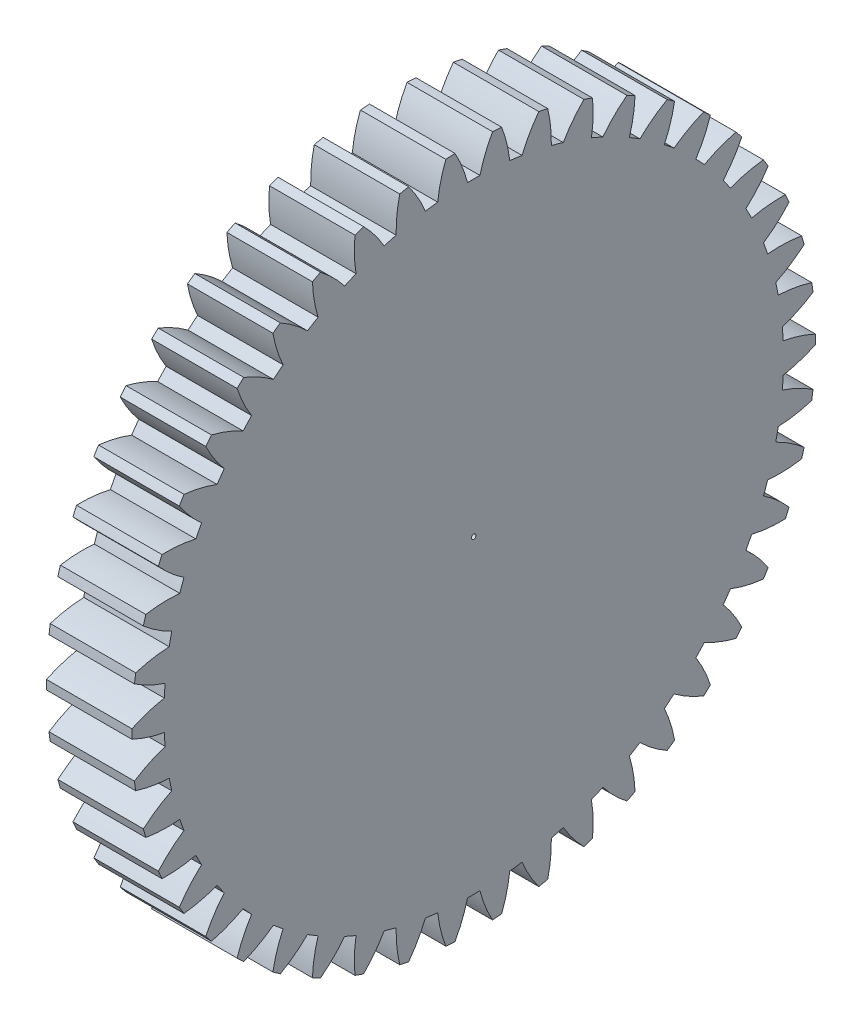
from build123d import *

# Parameters (mm, degrees)
BASPROSKE_W         = 12
BASPROSKE_H         = 60
TOOTHCUT_DEPTH      = 86.697141143
TEETHCUTS_COUNT     = 46
BORSKE_R            = 0.4
BORE_DEPTH          = 50.0000508
BOSS_EXTRUDE1_START = 3
BOSS_EXTRUDE1_DEPTH = 3


with BuildPart() as part:
    # BasProSke → Base-Revolve (revolve)
    with BuildSketch(Plane(origin=(0, 0, 0), x_dir=(1, 0, 0), z_dir=(0, 1, 0)), mode=Mode.PRIVATE) as base_revolve_sk:
        with Locations((6, 30)):
            Rectangle(BASPROSKE_W, BASPROSKE_H)
    revolve(base_revolve_sk.sketch.rotate(Axis((-10, 0, 0), (1, 0, 0)), 180), axis=Axis((-10, 0, 0), (1, 0, 0)))

    # TooCutSke → ToothCut (cut, through all)
    with BuildSketch(Plane(origin=(0, 0, 0), x_dir=(0, 0, -1), z_dir=(1, 0, 0))):
        with BuildLine():
            ThreePointArc((1.090953439, 54.363054519), (0, 54.374), (-1.090953439, 54.363054519))
            ThreePointArc((-1.090953439, 54.363054519), (-2.018224554, 57.221193322), (-3.310181513, 59.934058293))
            ThreePointArc((-3.310181513, 59.934058293), (0, 60.0254), (3.310181513, 59.934058293))
            ThreePointArc((3.310181513, 59.934058293), (2.018224554, 57.221193322), (1.090953439, 54.363054519))
        make_face()
    toothcut = extrude(amount=TOOTHCUT_DEPTH, mode=Mode.SUBTRACT)

    # TeethCuts: ToothCut ×46 about axis
    teethcuts_axis = Axis((0, 0, 0), (1, 0, 0))
    for i in range(1, TEETHCUTS_COUNT):
        add(toothcut.rotate(teethcuts_axis, i * 360 / TEETHCUTS_COUNT), mode=Mode.SUBTRACT)

    # BorSke → Bore (cut, symmetric)
    with BuildSketch(Plane(origin=(0, 0, 0), x_dir=(0, 0, -1), z_dir=(1, 0, 0))):
        with Locations(Location((0, 0, 0), (0, 0, 180))):
            Circle(BORSKE_R)
    extrude(amount=BORE_DEPTH, both=True, mode=Mode.SUBTRACT)

    # Sketch13 → Boss-Extrude1 (add)
    with BuildSketch(Plane.ZY.offset(BOSS_EXTRUDE1_START)):
        with BuildLine():
            ThreePointArc((54.310770987, -2.621455863), (57.21206929, -1.895710457), (59.994671195, -0.799642543))
            ThreePointArc((59.994671195, -0.799642543), (60, 0), (59.994671195, 0.799642543))
            ThreePointArc((59.994671195, 0.799642543), (57.21206929, 1.895710457), (54.310770987, 2.621455863))
            ThreePointArc((54.310770987, 2.621455863), (54.247241656, 3.710612984), (54.161872395, 4.798276213))
            ThreePointArc((54.161872395, 4.798276213), (56.937325529, 5.912322055), (59.544762236, 7.377078711))
            ThreePointArc((59.544762236, 7.377078711), (59.441156762, 8.169998946), (59.326992944, 8.96146797))
            ThreePointArc((59.326992944, 8.96146797), (56.421060448, 9.668429471), (53.447962674, 9.992355177))
            ThreePointArc((53.447962674, 9.992355177), (53.236718184, 11.062717254), (53.0040406, 12.128625482))
            ThreePointArc((53.0040406, 12.128625482), (55.601947124, 13.610219194), (57.985647019, 15.416378946))
            ThreePointArc((57.985647019, 15.416378946), (57.775037241, 16.187806269), (57.554165066, 16.956358204))
            ThreePointArc((57.554165066, 16.956358204), (54.579034003, 17.261043937), (51.589519945, 17.17711582))
            ThreePointArc((51.589519945, 17.17711582), (51.234495379, 18.208744032), (50.858843815, 19.233041407))
            ThreePointArc((50.858843815, 19.233041407), (53.230809647, 21.054583701), (55.346368911, 23.168501211))
            ThreePointArc((55.346368911, 23.168501211), (55.03267809, 23.904065391), (54.709211989, 24.635383567))
            ThreePointArc((54.709211989, 24.635383567), (51.720303423, 24.532117813), (48.770062069, 24.041899296))
            ThreePointArc((48.770062069, 24.041899296), (48.277870865, 25.015576362), (47.766242999, 25.979182161))
            ThreePointArc((47.766242999, 25.979182161), (49.868082903, 28.106741151), (51.67609267, 30.489038135))
            ThreePointArc((51.67609267, 30.489038135), (51.265164273, 31.175037002), (50.845129807, 31.855498346))
            ThreePointArc((50.845129807, 31.855498346), (47.898121448, 31.346204751), (45.042110214, 30.458827676))
            ThreePointArc((45.042110214, 30.458827676), (44.421920963, 31.356415835), (43.783847453, 32.241379905))
            ThreePointArc((43.783847453, 32.241379905), (45.576408128, 34.635323193), (47.043188597, 37.241621966))
            ThreePointArc((47.043188597, 37.241621966), (46.542677442, 37.86527666), (46.033899059, 38.482205464))
            ThreePointArc((46.033899059, 38.482205464), (43.183688097, 37.576371204), (40.475109069, 36.308365728))
            ThreePointArc((40.475109069, 36.308365728), (39.738474722, 37.113144609), (38.985841671, 37.902981745))
            ThreePointArc((38.985841671, 37.902981745), (40.435731104, 40.518714696), (41.53395893, 43.300464843))
            ThreePointArc((41.53395893, 43.300464843), (40.953188593, 43.850157857), (40.365143871, 44.392061906))
            ThreePointArc((40.365143871, 44.392061906), (37.664824343, 43.106560959), (35.154133224, 41.481547624))
            ThreePointArc((35.154133224, 41.481547624), (34.314775885, 42.178525721), (33.461603423, 42.858522751))
            ThreePointArc((33.461603423, 42.858522751), (34.541812916, 45.647319209), (35.251030193, 48.552701988))
            ThreePointArc((35.251030193, 48.552701988), (34.600819327, 49.018193581), (33.944462427, 49.474978227))
            ThreePointArc((33.944462427, 49.474978227), (31.444336177, 47.833757044), (29.178302391, 45.882006774))
            ThreePointArc((29.178302391, 45.882006774), (28.251857699, 46.458200703), (27.314038815, 47.015690568))
            ThreePointArc((27.314038815, 47.015690568), (28.00444611, 49.925600533), (28.311441461, 52.90049416))
            ThreePointArc((28.311441461, 52.90049416), (27.603902264, 53.273113104), (26.891459873, 53.636269314))
            ThreePointArc((26.891459873, 53.636269314), (24.638099523, 51.669900739), (22.658934991, 49.42777095))
            ThreePointArc((22.658934991, 49.42777095), (21.662660859, 49.872447308), (20.657665344, 50.297045028))
            ThreePointArc((20.657665344, 50.297045028), (20.945409459, 53.273862382), (20.844464142, 56.262850218))
            ThreePointArc((20.844464142, 56.262850218), (20.09277673, 56.535655327), (19.337520302, 56.798418187))
            ThreePointArc((19.337520302, 56.798418187), (17.372901692, 54.543531948), (15.717474506, 52.052789274))
            ThreePointArc((15.717474506, 52.052789274), (14.669929635, 52.357664582), (13.616478653, 52.641460704))
            ThreePointArc((13.616478653, 52.641460704), (13.49619946, 55.629732973), (12.989193896, 58.577135829))
            ThreePointArc((12.989193896, 58.577135829), (12.207360783, 58.745045261), (11.423359316, 58.902519997))
            ThreePointArc((11.423359316, 58.902519997), (9.784079572, 56.401120356), (8.483227208, 53.708162621))
            ThreePointArc((8.483227208, 53.708162621), (7.403925378, 53.86755763), (6.321642728, 54.005265569))
            ThreePointArc((6.321642728, 54.005265569), (5.795580801, 56.949326894), (4.891959543, 59.800240232))
            ThreePointArc((4.891959543, 59.800240232), (4.094544802, 59.860126151), (3.296402759, 59.909379306))
            ThreePointArc((3.296402759, 59.909379306), (2.012998563, 57.208062608), (1.090953439, 54.363054519))
            ThreePointArc((1.090953439, 54.363054519), (0, 54.374), (-1.090953439, 54.363054519))
            ThreePointArc((-1.090953439, 54.363054519), (-2.012998563, 57.208062608), (-3.296402759, 59.909379306))
            ThreePointArc((-3.296402759, 59.909379306), (-4.094544802, 59.860126151), (-4.891959543, 59.800240232))
            ThreePointArc((-4.891959543, 59.800240232), (-5.795580801, 56.949326894), (-6.321642728, 54.005265569))
            ThreePointArc((-6.321642728, 54.005265569), (-7.403925378, 53.86755763), (-8.483227208, 53.708162621))
            ThreePointArc((-8.483227208, 53.708162621), (-9.784079572, 56.401120356), (-11.423359316, 58.902519997))
            ThreePointArc((-11.423359316, 58.902519997), (-12.207360783, 58.745045261), (-12.989193896, 58.577135829))
            ThreePointArc((-12.989193896, 58.577135829), (-13.49619946, 55.629732973), (-13.616478653, 52.641460704))
            ThreePointArc((-13.616478653, 52.641460704), (-14.669929635, 52.357664582), (-15.717474506, 52.052789274))
            ThreePointArc((-15.717474506, 52.052789274), (-17.372901692, 54.543531948), (-19.337520302, 56.798418187))
            ThreePointArc((-19.337520302, 56.798418187), (-20.09277673, 56.535655327), (-20.844464142, 56.262850218))
            ThreePointArc((-20.844464142, 56.262850218), (-20.945409459, 53.273862382), (-20.657665344, 50.297045028))
            ThreePointArc((-20.657665344, 50.297045028), (-21.662660859, 49.872447308), (-22.658934991, 49.42777095))
            ThreePointArc((-22.658934991, 49.42777095), (-24.638099523, 51.669900739), (-26.891459873, 53.636269314))
            ThreePointArc((-26.891459873, 53.636269314), (-27.603902264, 53.273113104), (-28.311441461, 52.90049416))
            ThreePointArc((-28.311441461, 52.90049416), (-28.00444611, 49.925600533), (-27.314038815, 47.015690568))
            ThreePointArc((-27.314038815, 47.015690568), (-28.251857699, 46.458200703), (-29.178302391, 45.882006774))
            ThreePointArc((-29.178302391, 45.882006774), (-31.444336177, 47.833757044), (-33.944462427, 49.474978227))
            ThreePointArc((-33.944462427, 49.474978227), (-34.600819327, 49.018193581), (-35.251030193, 48.552701988))
            ThreePointArc((-35.251030193, 48.552701988), (-34.541812916, 45.647319209), (-33.461603423, 42.858522751))
            ThreePointArc((-33.461603423, 42.858522751), (-34.314775885, 42.178525721), (-35.154133224, 41.481547624))
            ThreePointArc((-35.154133224, 41.481547624), (-37.664824343, 43.106560959), (-40.365143871, 44.392061906))
            ThreePointArc((-40.365143871, 44.392061906), (-40.953188593, 43.850157857), (-41.53395893, 43.300464843))
            ThreePointArc((-41.53395893, 43.300464843), (-40.435731104, 40.518714696), (-38.985841671, 37.902981745))
            ThreePointArc((-38.985841671, 37.902981745), (-39.738474722, 37.113144609), (-40.475109069, 36.308365728))
            ThreePointArc((-40.475109069, 36.308365728), (-43.183688097, 37.576371204), (-46.033899059, 38.482205464))
            ThreePointArc((-46.033899059, 38.482205464), (-46.542677442, 37.86527666), (-47.043188597, 37.241621966))
            ThreePointArc((-47.043188597, 37.241621966), (-45.576408128, 34.635323193), (-43.783847453, 32.241379905))
            ThreePointArc((-43.783847453, 32.241379905), (-44.421920963, 31.356415835), (-45.042110214, 30.458827676))
            ThreePointArc((-45.042110214, 30.458827676), (-47.898121448, 31.346204751), (-50.845129807, 31.855498346))
            ThreePointArc((-50.845129807, 31.855498346), (-51.265164273, 31.175037002), (-51.67609267, 30.489038135))
            ThreePointArc((-51.67609267, 30.489038135), (-49.868082903, 28.106741151), (-47.766242999, 25.979182161))
            ThreePointArc((-47.766242999, 25.979182161), (-48.277870865, 25.015576362), (-48.770062069, 24.041899296))
            ThreePointArc((-48.770062069, 24.041899296), (-51.720303423, 24.532117813), (-54.709211989, 24.635383567))
            ThreePointArc((-54.709211989, 24.635383567), (-55.03267809, 23.904065391), (-55.346368911, 23.168501211))
            ThreePointArc((-55.346368911, 23.168501211), (-53.230809647, 21.054583701), (-50.858843815, 19.233041407))
            ThreePointArc((-50.858843815, 19.233041407), (-51.234495379, 18.208744032), (-51.589519945, 17.17711582))
            ThreePointArc((-51.589519945, 17.17711582), (-54.579034003, 17.261043937), (-57.554165066, 16.956358204))
            ThreePointArc((-57.554165066, 16.956358204), (-57.775037241, 16.187806269), (-57.985647019, 15.416378946))
            ThreePointArc((-57.985647019, 15.416378946), (-55.601947124, 13.610219194), (-53.0040406, 12.128625482))
            ThreePointArc((-53.0040406, 12.128625482), (-53.236718184, 11.062717254), (-53.447962674, 9.992355177))
            ThreePointArc((-53.447962674, 9.992355177), (-56.421060448, 9.668429471), (-59.326992944, 8.96146797))
            ThreePointArc((-59.326992944, 8.96146797), (-59.441156762, 8.169998946), (-59.544762236, 7.377078711))
            ThreePointArc((-59.544762236, 7.377078711), (-56.937325529, 5.912322055), (-54.161872395, 4.798276213))
            ThreePointArc((-54.161872395, 4.798276213), (-54.247241656, 3.710612984), (-54.310770987, 2.621455863))
            ThreePointArc((-54.310770987, 2.621455863), (-57.21206929, 1.895710457), (-59.994671195, 0.799642543))
            ThreePointArc((-59.994671195, 0.799642543), (-60, 0), (-59.994671195, -0.799642543))
            ThreePointArc((-59.994671195, -0.799642543), (-57.21206929, -1.895710457), (-54.310770987, -2.621455863))
            ThreePointArc((-54.310770987, -2.621455863), (-54.247241656, -3.710612984), (-54.161872395, -4.798276213))
            ThreePointArc((-54.161872395, -4.798276213), (-56.937325529, -5.912322055), (-59.544762236, -7.377078711))
            ThreePointArc((-59.544762236, -7.377078711), (-59.441156762, -8.169998946), (-59.326992944, -8.96146797))
            ThreePointArc((-59.326992944, -8.96146797), (-56.421060448, -9.668429471), (-53.447962674, -9.992355177))
            ThreePointArc((-53.447962674, -9.992355177), (-53.236718184, -11.062717254), (-53.0040406, -12.128625482))
            ThreePointArc((-53.0040406, -12.128625482), (-55.601947124, -13.610219194), (-57.985647019, -15.416378946))
            ThreePointArc((-57.985647019, -15.416378946), (-57.775037241, -16.187806269), (-57.554165066, -16.956358204))
            ThreePointArc((-57.554165066, -16.956358204), (-54.579034003, -17.261043937), (-51.589519945, -17.17711582))
            ThreePointArc((-51.589519945, -17.17711582), (-51.234495379, -18.208744032), (-50.858843815, -19.233041407))
            ThreePointArc((-50.858843815, -19.233041407), (-53.230809647, -21.054583701), (-55.346368911, -23.168501211))
            ThreePointArc((-55.346368911, -23.168501211), (-55.03267809, -23.904065391), (-54.709211989, -24.635383567))
            ThreePointArc((-54.709211989, -24.635383567), (-51.720303423, -24.532117813), (-48.770062069, -24.041899296))
            ThreePointArc((-48.770062069, -24.041899296), (-48.277870865, -25.015576362), (-47.766242999, -25.979182161))
            ThreePointArc((-47.766242999, -25.979182161), (-49.868082903, -28.106741151), (-51.67609267, -30.489038135))
            ThreePointArc((-51.67609267, -30.489038135), (-51.265164273, -31.175037002), (-50.845129807, -31.855498346))
            ThreePointArc((-50.845129807, -31.855498346), (-47.898121448, -31.346204751), (-45.042110214, -30.458827676))
            ThreePointArc((-45.042110214, -30.458827676), (-44.421920963, -31.356415835), (-43.783847453, -32.241379905))
            ThreePointArc((-43.783847453, -32.241379905), (-45.576408128, -34.635323193), (-47.043188597, -37.241621966))
            ThreePointArc((-47.043188597, -37.241621966), (-46.542677442, -37.86527666), (-46.033899059, -38.482205464))
            ThreePointArc((-46.033899059, -38.482205464), (-43.183688097, -37.576371204), (-40.475109069, -36.308365728))
            ThreePointArc((-40.475109069, -36.308365728), (-39.738474722, -37.113144609), (-38.985841671, -37.902981745))
            ThreePointArc((-38.985841671, -37.902981745), (-40.435731104, -40.518714696), (-41.53395893, -43.300464843))
            ThreePointArc((-41.53395893, -43.300464843), (-40.953188593, -43.850157857), (-40.365143871, -44.392061906))
            ThreePointArc((-40.365143871, -44.392061906), (-37.664824343, -43.106560959), (-35.154133224, -41.481547624))
            ThreePointArc((-35.154133224, -41.481547624), (-34.314775885, -42.178525721), (-33.461603423, -42.858522751))
            ThreePointArc((-33.461603423, -42.858522751), (-34.541812916, -45.647319209), (-35.251030193, -48.552701988))
            ThreePointArc((-35.251030193, -48.552701988), (-34.600819327, -49.018193581), (-33.944462427, -49.474978227))
            ThreePointArc((-33.944462427, -49.474978227), (-31.444336177, -47.833757044), (-29.178302391, -45.882006774))
            ThreePointArc((-29.178302391, -45.882006774), (-28.251857699, -46.458200703), (-27.314038815, -47.015690568))
            ThreePointArc((-27.314038815, -47.015690568), (-28.00444611, -49.925600533), (-28.311441461, -52.90049416))
            ThreePointArc((-28.311441461, -52.90049416), (-27.603902264, -53.273113104), (-26.891459873, -53.636269314))
            ThreePointArc((-26.891459873, -53.636269314), (-24.638099523, -51.669900739), (-22.658934991, -49.42777095))
            ThreePointArc((-22.658934991, -49.42777095), (-21.662660859, -49.872447308), (-20.657665344, -50.297045028))
            ThreePointArc((-20.657665344, -50.297045028), (-20.945409459, -53.273862382), (-20.844464142, -56.262850218))
            ThreePointArc((-20.844464142, -56.262850218), (-20.09277673, -56.535655327), (-19.337520302, -56.798418187))
            ThreePointArc((-19.337520302, -56.798418187), (-17.372901692, -54.543531948), (-15.717474506, -52.052789274))
            ThreePointArc((-15.717474506, -52.052789274), (-14.669929635, -52.357664582), (-13.616478653, -52.641460704))
            ThreePointArc((-13.616478653, -52.641460704), (-13.49619946, -55.629732973), (-12.989193896, -58.577135829))
            ThreePointArc((-12.989193896, -58.577135829), (-12.207360783, -58.745045261), (-11.423359316, -58.902519997))
            ThreePointArc((-11.423359316, -58.902519997), (-9.784079572, -56.401120356), (-8.483227208, -53.708162621))
            ThreePointArc((-8.483227208, -53.708162621), (-7.403925378, -53.86755763), (-6.321642728, -54.005265569))
            ThreePointArc((-6.321642728, -54.005265569), (-5.795580801, -56.949326894), (-4.891959543, -59.800240232))
            ThreePointArc((-4.891959543, -59.800240232), (-4.094544802, -59.860126151), (-3.296402759, -59.909379306))
            ThreePointArc((-3.296402759, -59.909379306), (-2.012998563, -57.208062608), (-1.090953439, -54.363054519))
            ThreePointArc((-1.090953439, -54.363054519), (0, -54.374), (1.090953439, -54.363054519))
            ThreePointArc((1.090953439, -54.363054519), (2.012998563, -57.208062608), (3.296402759, -59.909379306))
            ThreePointArc((3.296402759, -59.909379306), (4.094544802, -59.860126151), (4.891959543, -59.800240232))
            ThreePointArc((4.891959543, -59.800240232), (5.795580801, -56.949326894), (6.321642728, -54.005265569))
            ThreePointArc((6.321642728, -54.005265569), (7.403925378, -53.86755763), (8.483227208, -53.708162621))
            ThreePointArc((8.483227208, -53.708162621), (9.784079572, -56.401120356), (11.423359316, -58.902519997))
            ThreePointArc((11.423359316, -58.902519997), (12.207360783, -58.745045261), (12.989193896, -58.577135829))
            ThreePointArc((12.989193896, -58.577135829), (13.49619946, -55.629732973), (13.616478653, -52.641460704))
            ThreePointArc((13.616478653, -52.641460704), (14.669929635, -52.357664582), (15.717474506, -52.052789274))
            ThreePointArc((15.717474506, -52.052789274), (17.372901692, -54.543531948), (19.337520302, -56.798418187))
            ThreePointArc((19.337520302, -56.798418187), (20.09277673, -56.535655327), (20.844464142, -56.262850218))
            ThreePointArc((20.844464142, -56.262850218), (20.945409459, -53.273862382), (20.657665344, -50.297045028))
            ThreePointArc((20.657665344, -50.297045028), (21.662660859, -49.872447308), (22.658934991, -49.42777095))
            ThreePointArc((22.658934991, -49.42777095), (24.638099523, -51.669900739), (26.891459873, -53.636269314))
            ThreePointArc((26.891459873, -53.636269314), (27.603902264, -53.273113104), (28.311441461, -52.90049416))
            ThreePointArc((28.311441461, -52.90049416), (28.00444611, -49.925600533), (27.314038815, -47.015690568))
            ThreePointArc((27.314038815, -47.015690568), (28.251857699, -46.458200703), (29.178302391, -45.882006774))
            ThreePointArc((29.178302391, -45.882006774), (31.444336177, -47.833757044), (33.944462427, -49.474978227))
            ThreePointArc((33.944462427, -49.474978227), (34.600819327, -49.018193581), (35.251030193, -48.552701988))
            ThreePointArc((35.251030193, -48.552701988), (34.541812916, -45.647319209), (33.461603423, -42.858522751))
            ThreePointArc((33.461603423, -42.858522751), (34.314775885, -42.178525721), (35.154133224, -41.481547624))
            ThreePointArc((35.154133224, -41.481547624), (37.664824343, -43.106560959), (40.365143871, -44.392061906))
            ThreePointArc((40.365143871, -44.392061906), (40.953188593, -43.850157857), (41.53395893, -43.300464843))
            ThreePointArc((41.53395893, -43.300464843), (40.435731104, -40.518714696), (38.985841671, -37.902981745))
            ThreePointArc((38.985841671, -37.902981745), (39.738474722, -37.113144609), (40.475109069, -36.308365728))
            ThreePointArc((40.475109069, -36.308365728), (43.183688097, -37.576371204), (46.033899059, -38.482205464))
            ThreePointArc((46.033899059, -38.482205464), (46.542677442, -37.86527666), (47.043188597, -37.241621966))
            ThreePointArc((47.043188597, -37.241621966), (45.576408128, -34.635323193), (43.783847453, -32.241379905))
            ThreePointArc((43.783847453, -32.241379905), (44.421920963, -31.356415835), (45.042110214, -30.458827676))
            ThreePointArc((45.042110214, -30.458827676), (47.898121448, -31.346204751), (50.845129807, -31.855498346))
            ThreePointArc((50.845129807, -31.855498346), (51.265164273, -31.175037002), (51.67609267, -30.489038135))
            ThreePointArc((51.67609267, -30.489038135), (49.868082903, -28.106741151), (47.766242999, -25.979182161))
            ThreePointArc((47.766242999, -25.979182161), (48.277870865, -25.015576362), (48.770062069, -24.041899296))
            ThreePointArc((48.770062069, -24.041899296), (51.720303423, -24.532117813), (54.709211989, -24.635383567))
            ThreePointArc((54.709211989, -24.635383567), (55.03267809, -23.904065391), (55.346368911, -23.168501211))
            ThreePointArc((55.346368911, -23.168501211), (53.230809647, -21.054583701), (50.858843815, -19.233041407))
            ThreePointArc((50.858843815, -19.233041407), (51.234495379, -18.208744032), (51.589519945, -17.17711582))
            ThreePointArc((51.589519945, -17.17711582), (54.579034003, -17.261043937), (57.554165066, -16.956358204))
            ThreePointArc((57.554165066, -16.956358204), (57.775037241, -16.187806269), (57.985647019, -15.416378946))
            ThreePointArc((57.985647019, -15.416378946), (55.601947124, -13.610219194), (53.0040406, -12.128625482))
            ThreePointArc((53.0040406, -12.128625482), (53.236718184, -11.062717254), (53.447962674, -9.992355177))
            ThreePointArc((53.447962674, -9.992355177), (56.421060448, -9.668429471), (59.326992944, -8.96146797))
            ThreePointArc((59.326992944, -8.96146797), (59.441156762, -8.169998946), (59.544762236, -7.377078711))
            ThreePointArc((59.544762236, -7.377078711), (56.937325529, -5.912322055), (54.161872395, -4.798276213))
            ThreePointArc((54.161872395, -4.798276213), (54.247241656, -3.710612984), (54.310770987, -2.621455863))
        make_face()
    extrude(amount=-BOSS_EXTRUDE1_DEPTH)


solid = part.part
